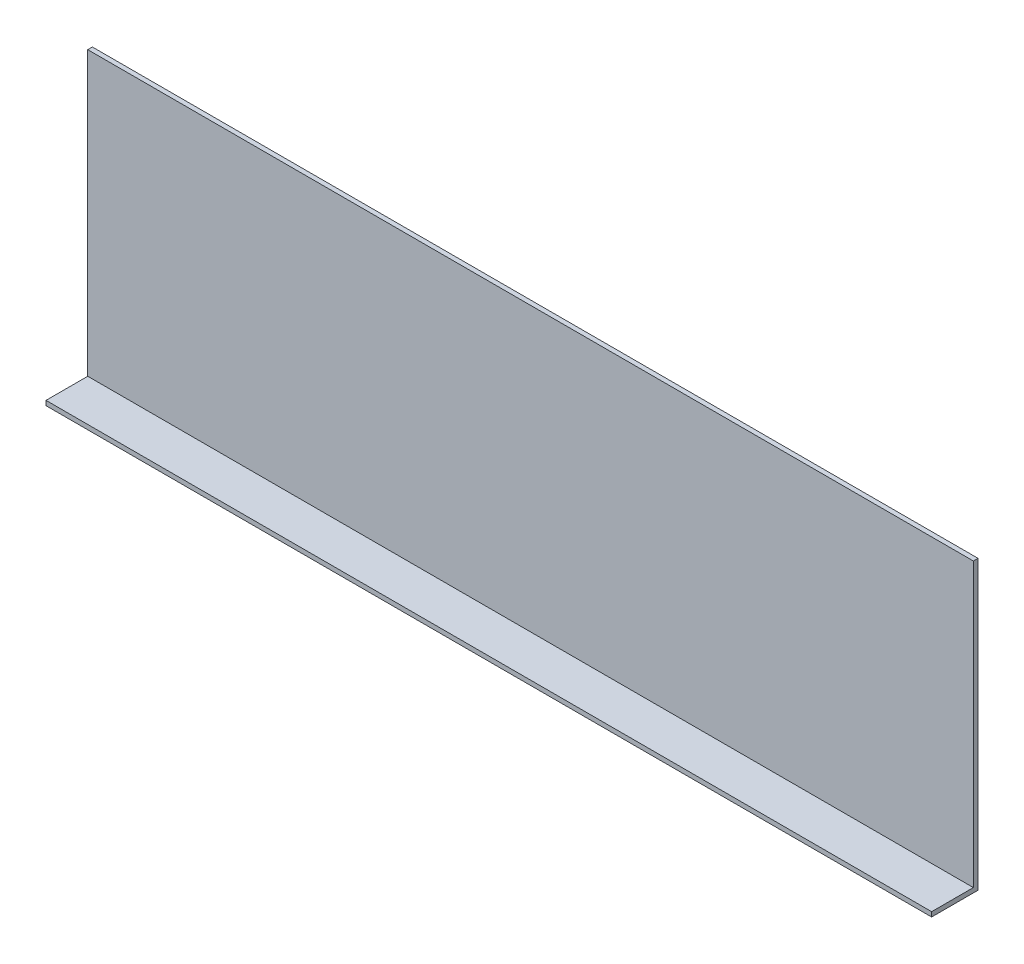
from build123d import *

# Parameters (mm, degrees)
SKETCH1_W           = 955
SKETCH1_H           = 310
BOSS_EXTRUDE1_DEPTH = 5
BOSS_EXTRUDE2_START = 5
SKETCH2_W           = 955
SKETCH2_H           = 5
BOSS_EXTRUDE2_DEPTH = 45


with BuildPart() as part:
    # Sketch1 → Boss-Extrude1 (new body)
    with BuildSketch(Plane.XY):
        Rectangle(SKETCH1_W, SKETCH1_H)
    extrude(amount=BOSS_EXTRUDE1_DEPTH)

    # Sketch2 → Boss-Extrude2 (add)
    with BuildSketch(Plane.XY.offset(BOSS_EXTRUDE2_START)):
        with Locations((0, -152.5)):
            Rectangle(SKETCH2_W, SKETCH2_H)
    extrude(amount=BOSS_EXTRUDE2_DEPTH)


solid = part.part
